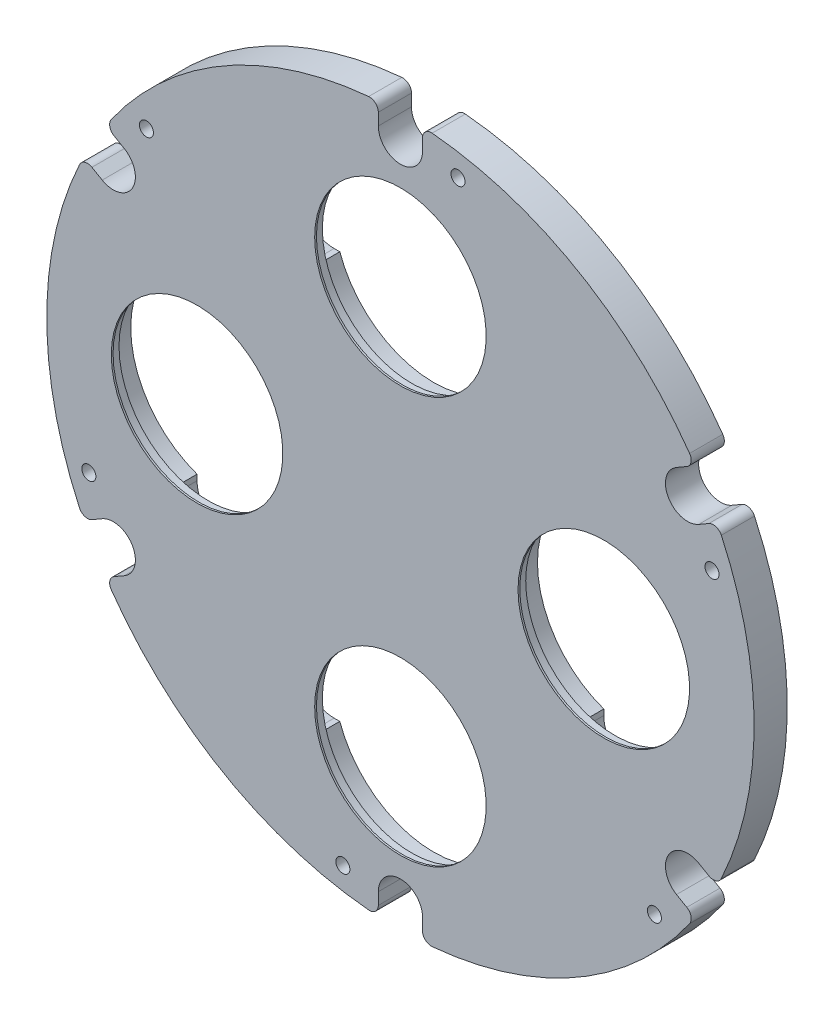
from build123d import *

# Parameters (mm, degrees)
BOSS_EXTRUDE1_DEPTH      = 9.525
F_10_32_TAPPED_HOLE1_D   = 4.0386
SUBSTRATE_CSINK_R        = 25.654
CUT_EXTRUDE1_DEPTH       = 9.017
SUBSTRATE_SURFACE_HOLE_R = 24.638
CUT_EXTRUDE2_DEPTH       = 144.717719729
CUT_EXTRUDE3_DEPTH       = 6.2992


with BuildPart() as part:
    # Front Plate Main → Boss-Extrude1 (new body)
    with BuildSketch(Plane.XY):
        with BuildLine():
            Line((-6.35, 98.660283296), (-6.35, 95.25))
            ThreePointArc((-6.35, 95.25), (0, 88.9), (6.35, 95.25))
            Line((6.35, 95.25), (6.35, 98.660283296))
            ThreePointArc((6.35, 98.660283296), (7.176434965, 100.53519526), (9.117948718, 101.190034149))
            ThreePointArc((9.117948718, 101.190034149), (50.8, 87.988181024), (83.074165824, 58.491392295))
            ThreePointArc((83.074165824, 58.491392295), (83.477815587, 56.482572618), (82.267311679, 54.829402962))
            Line((82.267311679, 54.829402962), (79.31391971, 53.124261314))
            ThreePointArc((79.31391971, 53.124261314), (76.989658396, 44.45), (85.66391971, 42.125738686))
            Line((85.66391971, 42.125738686), (88.617311679, 43.830880334))
            ThreePointArc((88.617311679, 43.830880334), (90.654250552, 44.052622641), (92.192114542, 42.698641855))
            ThreePointArc((92.192114542, 42.698641855), (101.6, 0), (92.192114542, -42.698641855))
            ThreePointArc((92.192114542, -42.698641855), (90.654250552, -44.052622641), (88.617311679, -43.830880334))
            Line((88.617311679, -43.830880334), (85.66391971, -42.125738686))
            ThreePointArc((85.66391971, -42.125738686), (76.989658396, -44.45), (79.31391971, -53.124261314))
            Line((79.31391971, -53.124261314), (82.267311679, -54.829402962))
            ThreePointArc((82.267311679, -54.829402962), (83.477815587, -56.482572618), (83.074165824, -58.491392295))
            ThreePointArc((83.074165824, -58.491392295), (50.8, -87.988181024), (9.117948718, -101.190034149))
            ThreePointArc((9.117948718, -101.190034149), (7.176434965, -100.53519526), (6.35, -98.660283296))
            Line((6.35, -98.660283296), (6.35, -95.25))
            ThreePointArc((6.35, -95.25), (0, -88.9), (-6.35, -95.25))
            Line((-6.35, -95.25), (-6.35, -98.660283296))
            ThreePointArc((-6.35, -98.660283296), (-7.176434965, -100.53519526), (-9.117948718, -101.190034149))
            ThreePointArc((-9.117948718, -101.190034149), (-50.8, -87.988181024), (-83.074165824, -58.491392295))
            ThreePointArc((-83.074165824, -58.491392295), (-83.477815587, -56.482572618), (-82.267311679, -54.829402962))
            Line((-82.267311679, -54.829402962), (-79.31391971, -53.124261314))
            ThreePointArc((-79.31391971, -53.124261314), (-76.989658396, -44.45), (-85.66391971, -42.125738686))
            Line((-85.66391971, -42.125738686), (-88.617311679, -43.830880334))
            ThreePointArc((-88.617311679, -43.830880334), (-90.654250552, -44.052622641), (-92.192114542, -42.698641855))
            ThreePointArc((-92.192114542, -42.698641855), (-101.6, 0), (-92.192114542, 42.698641855))
            ThreePointArc((-92.192114542, 42.698641855), (-90.654250552, 44.052622641), (-88.617311679, 43.830880334))
            Line((-88.617311679, 43.830880334), (-85.66391971, 42.125738686))
            ThreePointArc((-85.66391971, 42.125738686), (-76.989658396, 44.45), (-79.31391971, 53.124261314))
            Line((-79.31391971, 53.124261314), (-82.267311679, 54.829402962))
            ThreePointArc((-82.267311679, 54.829402962), (-83.477815587, 56.482572618), (-83.074165824, 58.491392295))
            ThreePointArc((-83.074165824, 58.491392295), (-50.8, 87.988181024), (-9.117948718, 101.190034149))
            ThreePointArc((-9.117948718, 101.190034149), (-7.176434965, 100.53519526), (-6.35, 98.660283296))
        make_face()
    extrude(amount=BOSS_EXTRUDE1_DEPTH)

    # #10-32 Tapped Hole1 (through all)
    with Locations(Plane(origin=(0, 0, 0), x_dir=(-1, 0, 0), z_dir=(0, 0, -1))):
        with Locations((-16.539988923, 93.802938474), (72.965733207, 61.225519823), (89.50572213, -32.577418652), (16.539988923, -93.802938474), (-72.965733207, -61.225519823), (-89.50572213, 32.577418652)):
            Hole(F_10_32_TAPPED_HOLE1_D / 2)

    # Substrate CSink → Cut-Extrude1 (cut)
    with BuildSketch(Plane(origin=(0, 0, 0), x_dir=(-1, 0, 0), z_dir=(0, 0, -1))):
        with Locations((0, 58.42)):
            Circle(SUBSTRATE_CSINK_R)
        with Locations((58.42, 0)):
            Circle(SUBSTRATE_CSINK_R)
        with Locations((0, -58.42)):
            Circle(SUBSTRATE_CSINK_R)
        with Locations((-58.42, 0)):
            Circle(SUBSTRATE_CSINK_R)
    extrude(amount=-CUT_EXTRUDE1_DEPTH, mode=Mode.SUBTRACT)

    # Substrate Surface Hole → Cut-Extrude2 (cut, through all)
    with BuildSketch(Plane(origin=(0, 0, 0), x_dir=(-1, 0, 0), z_dir=(0, 0, -1))):
        with Locations((0, 58.42)):
            Circle(SUBSTRATE_SURFACE_HOLE_R)
        with Locations((58.42, 0)):
            Circle(SUBSTRATE_SURFACE_HOLE_R)
        with Locations((0, -58.42)):
            Circle(SUBSTRATE_SURFACE_HOLE_R)
        with Locations((-58.42, 0)):
            Circle(SUBSTRATE_SURFACE_HOLE_R)
    extrude(amount=-CUT_EXTRUDE2_DEPTH, mode=Mode.SUBTRACT)

    # Backer Clearance → Cut-Extrude3 (cut)
    with BuildSketch(Plane(origin=(0, 0, 0), x_dir=(-1, 0, 0), z_dir=(0, 0, -1))):
        with BuildLine():
            Line((-28.575, 67.945), (-26.940768363, 67.945))
            ThreePointArc((-26.940768363, 67.945), (0, 86.995), (26.940768363, 67.945))
            Line((26.940768363, 67.945), (28.575, 67.945))
            ThreePointArc((28.575, 67.945), (38.1, 58.42), (28.575, 48.895))
            Line((28.575, 48.895), (26.940768363, 48.895))
            ThreePointArc((26.940768363, 48.895), (0, 29.845), (-26.940768363, 48.895))
            Line((-26.940768363, 48.895), (-28.575, 48.895))
            ThreePointArc((-28.575, 48.895), (-38.1, 58.42), (-28.575, 67.945))
        make_face()
        with BuildLine():
            Line((67.945, 28.575), (67.945, 26.940768363))
            ThreePointArc((67.945, 26.940768363), (86.995, 0), (67.945, -26.940768363))
            Line((67.945, -26.940768363), (67.945, -28.575))
            ThreePointArc((67.945, -28.575), (58.42, -38.1), (48.895, -28.575))
            Line((48.895, -28.575), (48.895, -26.940768363))
            ThreePointArc((48.895, -26.940768363), (29.845, 0), (48.895, 26.940768363))
            Line((48.895, 26.940768363), (48.895, 28.575))
            ThreePointArc((48.895, 28.575), (58.42, 38.1), (67.945, 28.575))
        make_face()
        with BuildLine():
            Line((28.575, -67.945), (26.940768363, -67.945))
            ThreePointArc((26.940768363, -67.945), (0, -86.995), (-26.940768363, -67.945))
            Line((-26.940768363, -67.945), (-28.575, -67.945))
            ThreePointArc((-28.575, -67.945), (-38.1, -58.42), (-28.575, -48.895))
            Line((-28.575, -48.895), (-26.940768363, -48.895))
            ThreePointArc((-26.940768363, -48.895), (0, -29.845), (26.940768363, -48.895))
            Line((26.940768363, -48.895), (28.575, -48.895))
            ThreePointArc((28.575, -48.895), (38.1, -58.42), (28.575, -67.945))
        make_face()
        with BuildLine():
            Line((-67.945, -28.575), (-67.945, -26.940768363))
            ThreePointArc((-67.945, -26.940768363), (-86.995, 0), (-67.945, 26.940768363))
            Line((-67.945, 26.940768363), (-67.945, 28.575))
            ThreePointArc((-67.945, 28.575), (-58.42, 38.1), (-48.895, 28.575))
            Line((-48.895, 28.575), (-48.895, 26.940768363))
            ThreePointArc((-48.895, 26.940768363), (-29.845, 0), (-48.895, -26.940768363))
            Line((-48.895, -26.940768363), (-48.895, -28.575))
            ThreePointArc((-48.895, -28.575), (-58.42, -38.1), (-67.945, -28.575))
        make_face()
    extrude(amount=-CUT_EXTRUDE3_DEPTH, mode=Mode.SUBTRACT)


solid = part.part
